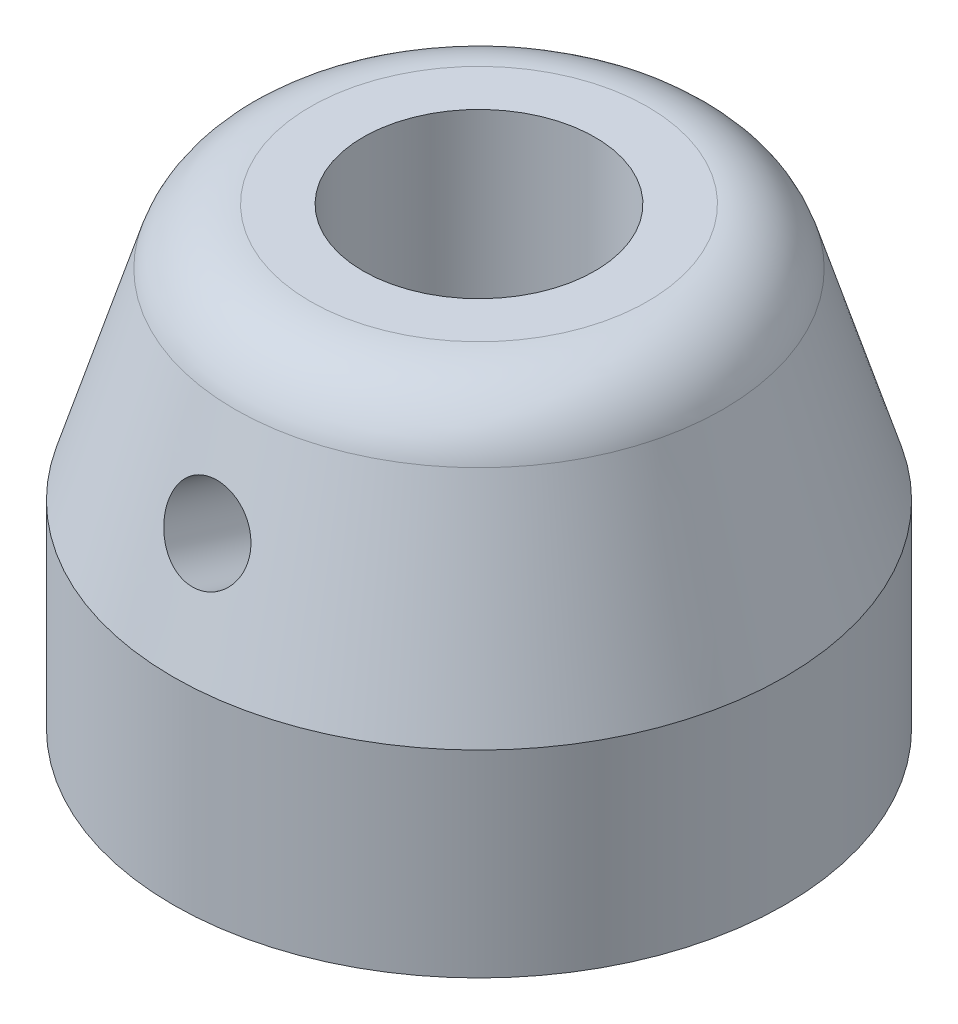
from build123d import *

# Parameters (mm, degrees)
FILLET1_R              = 8
M10_TAPPED_HOLE1_D     = 8.5
M10_TAPPED_HOLE1_DEPTH = 10
M10_TAPPED_HOLE1_TIP   = 2.553657631
M25X1_5_TAPPED_HOLE1_D = 23.5


with BuildPart() as part:
    # Sketch2 → Revolve1 (revolve)
    with BuildSketch(Plane.XY, mode=Mode.PRIVATE) as revolve1_sk:
        with BuildLine():
            Line((19.595917942, 0), (31, 0))
            Line((31, 0), (31, 20))
            Line((31, 20), (23, 46))
            Line((23, 46), (0, 46))
            Line((0, 46), (0, 4))
            ThreePointArc((0, 4), (10, 2.989794856), (19.595917942, 0))
        make_face()
    revolve(revolve1_sk.sketch.rotate(Axis((0, 46, 0), (0, -1, 0)), 90), axis=Axis((0, 46, 0), (0, -1, 0)))

    # Fillet1
    fillet1_edges = [part.edges().sort_by_distance(p)[0] for p in [
        (0, 46, -23),
    ]]
    fillet(fillet1_edges, radius=FILLET1_R)

    # M10 Tapped Hole1
    with Locations(Plane(origin=(-0.142010422, 30.849228359, 27.66141136), x_dir=(0, 0.955777919374, -0.294089389196), z_dir=(-0.00490679199, 0.294085848838, 0.955766413359))):
        with Locations((0, 0)):
            Hole(M10_TAPPED_HOLE1_D / 2, depth=M10_TAPPED_HOLE1_DEPTH)
            with Locations((0, 0, -(M10_TAPPED_HOLE1_DEPTH + M10_TAPPED_HOLE1_TIP / 2))):  # 118° drill point
                Cone(0, M10_TAPPED_HOLE1_D / 2, M10_TAPPED_HOLE1_TIP, mode=Mode.SUBTRACT)

    # M25x1.5 Tapped Hole1 (through all)
    with Locations(Plane.ZX.offset(46)):
        with Locations((0, 0)):
            Hole(M25X1_5_TAPPED_HOLE1_D / 2)


solid = part.part
